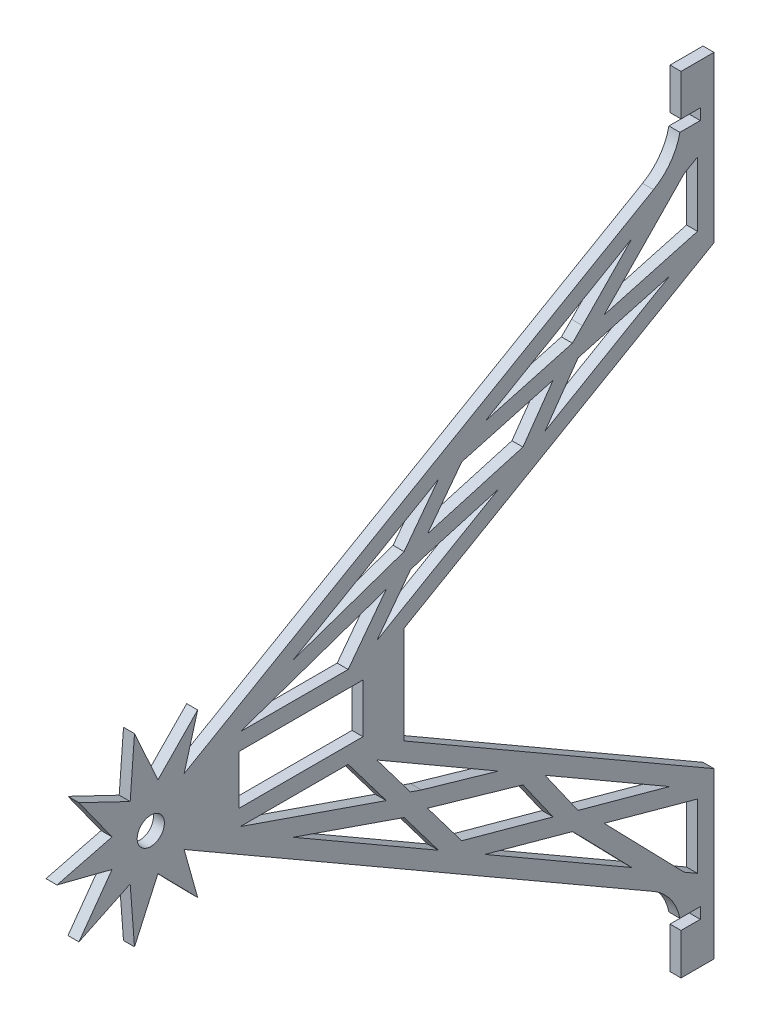
from build123d import *

# Parameters (mm, degrees)
SKETCH1_R               = 4.95
SKETCH1_W               = 17.9
SKETCH1_H               = 45.1
BOSS_EXTRUDE1_DEPTH     = 4
CUT_EXTRUDE1_DEPTH      = 251.804158421
CUT_EXTRUDE1_DEPTH_BACK = 251.804158421
SKETCH2_W               = 258.160615752
SKETCH2_H               = 10
SKETCH3_W               = 12
SKETCH3_H               = 60
BOSS_EXTRUDE2_DEPTH     = 4
FILLET1_R               = 20
BOSS_EXTRUDE3_START     = -4
BOSS_EXTRUDE3_DEPTH     = 4
CIRPATTERN1_COUNT       = 9
SKETCH5_W               = 17
SKETCH5_H               = 4
CUT_EXTRUDE2_DEPTH      = 250.918397673
CUT_EXTRUDE3_DEPTH      = 250.918397673


with BuildPart() as part:
    # Sketch1 → Boss-Extrude1 (new body)
    with BuildSketch(Plane.YZ):
        with BuildLine():
            Line((-10.899695646, -10.305175148), (-129.080307876, -215))
            Line((-129.080307876, -215), (-88.665789032, -215))
            Line((-88.665789032, -215), (-17.790269987, -92.24))
            Line((-17.790269987, -92.24), (17.790269987, -92.24))
            Line((17.790269987, -92.24), (88.665789032, -215))
            Line((88.665789032, -215), (129.080307876, -215))
            Line((129.080307876, -215), (10.899695646, -10.305175148))
            ThreePointArc((10.899695646, -10.305175148), (0, 15), (-10.899695646, -10.305175148))
        make_face()
        Circle(SKETCH1_R, mode=Mode.SUBTRACT)
        with Locations((0, -54.69)):
            Rectangle(SKETCH1_W, SKETCH1_H, mode=Mode.SUBTRACT)
    extrude(amount=BOSS_EXTRUDE1_DEPTH)

    # Sketch2 → Cut-Extrude1 (cut, two sides: drawn at the far end of the back side and taken through both)
    with BuildSketch(Plane.YZ.offset(4).offset(-CUT_EXTRUDE1_DEPTH_BACK)):
        with Locations((0, -210)):
            Rectangle(SKETCH2_W, SKETCH2_H)
    extrude(amount=CUT_EXTRUDE1_DEPTH + CUT_EXTRUDE1_DEPTH_BACK, mode=Mode.SUBTRACT)

    # Sketch3 → Boss-Extrude2 (add)
    with BuildSketch(Plane(origin=(4, 0, 0), x_dir=(0, 0, -1), z_dir=(1, 0, 0))):
        with Locations((199, -112.892286341)):
            Rectangle(SKETCH3_W, SKETCH3_H)
        with Locations((199, 112.892286341)):
            Rectangle(SKETCH3_W, SKETCH3_H)
    extrude(amount=-BOSS_EXTRUDE2_DEPTH)

    # Fillet1
    fillet1_edges = [part.edges().sort_by_distance(p)[0] for p in [
        (2, 116.378601954, -193),
        (2, -116.378601954, -193),
    ]]
    fillet(fillet1_edges, radius=FILLET1_R)

    # Sketch4 → Boss-Extrude3 (add)
    with BuildSketch(Plane(origin=(4, 0, 0), x_dir=(0, 0, -1), z_dir=(1, 0, 0)).offset(BOSS_EXTRUDE3_START)):
        with BuildLine():
            Line((-34.137962787, 0), (-14.095389312, -5.13030215))
            ThreePointArc((-14.095389312, -5.13030215), (-15, 0), (-14.095389312, 5.13030215))
            Line((-14.095389312, 5.13030215), (-34.137962787, 0))
        make_face()
    boss_extrude3 = extrude(amount=BOSS_EXTRUDE3_DEPTH)

    # CirPattern1: Boss-Extrude3 ×9 about axis
    cirpattern1_axis = Axis((-0.2, 0, 0), (1, 0, 0))
    for i in range(1, CIRPATTERN1_COUNT):
        add(boss_extrude3.rotate(cirpattern1_axis, i * 360 / CIRPATTERN1_COUNT))

    # Sketch5 → Cut-Extrude2 (cut, symmetric)
    with BuildSketch(Plane(origin=(4, 0, 0), x_dir=(0, 0, -1), z_dir=(1, 0, 0))):
        with Locations((191.5, -125.892286341)):
            Rectangle(SKETCH5_W, SKETCH5_H)
    cut_extrude2 = extrude(amount=CUT_EXTRUDE2_DEPTH, both=True, mode=Mode.SUBTRACT)

    # Mirror1: Cut-Extrude2 across plane
    add(cut_extrude2.mirror(Plane.ZX), mode=Mode.SUBTRACT)

    # Sketch6 → Cut-Extrude3 (cut, symmetric)
    with BuildSketch(Plane.YZ.offset(4)):
        Polygon((-44.440620352, -126.565865893), (-18.81339339, -82.279763058), (-34.966746745, -94.476691336), (-36.374058239, -98.54606889), align=None)
        Polygon((-33.320603167, -85.715441185), (-14.95, -71.844331927), (-14.95, -32.59506202), align=None)
        Polygon((-80.442842118, -188.780872527), (-54.234238638, -143.490099921), (-71.318419935, -155.512353255), align=None)
        Polygon((-41.912952433, -92.203274728), (-27.957868434, -51.850797102), (-58.475794969, -104.709396402), align=None)
        Polygon((-112.914500338, -199), (-89.467175046, -199), (-80.146284863, -165.015139537), (-110.110561046, -194.143434684), align=None)
        Polygon((-76.978433226, -153.464848336), (-68.249306861, -121.637615567), (-99.099637478, -175.071955626), (-80.672732205, -157.159147315), align=None)
        Polygon((-43.245914121, -100.728050325), (-59.700544534, -113.152464165), (-68.824966717, -146.420983438), (-53.243788825, -135.456403713), align=None)
    cut_extrude3 = extrude(amount=CUT_EXTRUDE3_DEPTH, both=True, mode=Mode.SUBTRACT)

    # Mirror2: Cut-Extrude3 across plane
    add(cut_extrude3.mirror(Plane.ZX), mode=Mode.SUBTRACT)


solid = part.part
